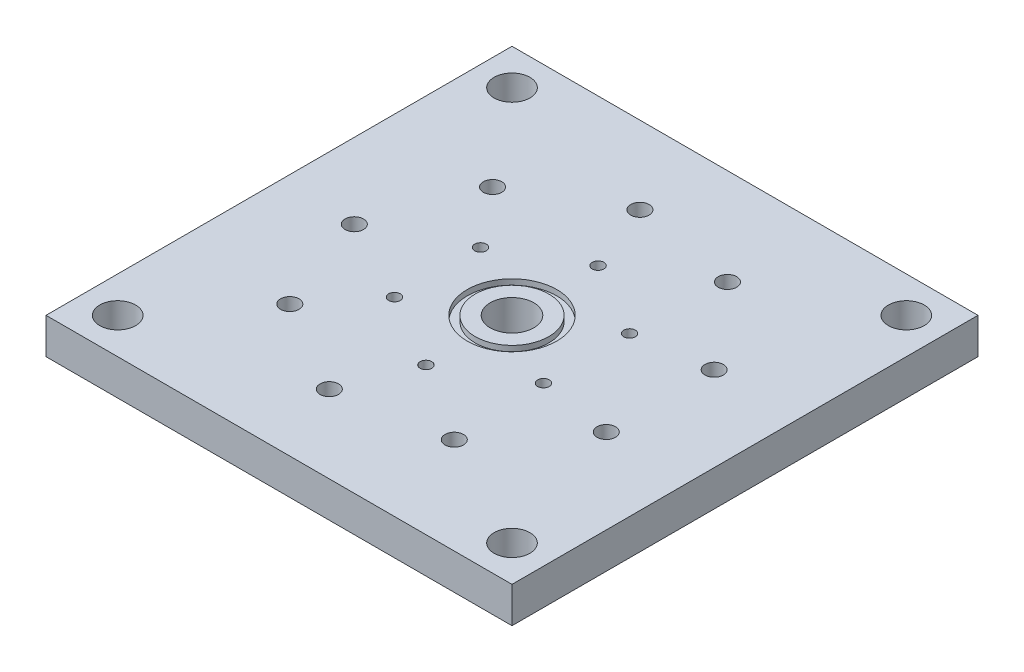
from build123d import *

# Parameters (mm, degrees)
SKETCH1_W           = 82.55
SKETCH1_H           = 82.55
BOSS_EXTRUDE1_DEPTH = 6.35
CUT_EXTRUDE1_REACH  = 60.716
SKETCH2_R           = 3.8608
SKETCH4_R           = 7.9248
SKETCH4_R_2         = 6.5278
CUT_EXTRUDE3_DEPTH  = 0.9779
SKETCH5_R           = 1.03251
CUT_EXTRUDE4_DEPTH  = 3.175
CIRPATTERN1_COUNT   = 6
CUT_EXTRUDE5_REACH  = 60.716
SKETCH6_R           = 1.63195
CIRPATTERN2_COUNT   = 9
CUT_EXTRUDE6_REACH  = 60.716
SKETCH7_R           = 3.175


with BuildPart() as part:
    # Sketch1 → Boss-Extrude1 (new body)
    with BuildSketch(Plane(origin=(0, 0, 0), x_dir=(1, 0, 0), z_dir=(0, 1, 0))):
        Rectangle(SKETCH1_W, SKETCH1_H)
    extrude(amount=BOSS_EXTRUDE1_DEPTH)

    # Sketch2 → Cut-Extrude1 (cut, up to next)
    with BuildSketch(Plane(origin=(0, 6.35, 0), x_dir=(1, 0, 0), z_dir=(0, 1, 0)), mode=Mode.PRIVATE) as cut_extrude1_sk1:
        with Locations(Location((0, 0, 0), (0, 0, 270))):
            Circle(SKETCH2_R)
    cut_extrude1_tool1 = extrude(cut_extrude1_sk1.sketch, amount=-CUT_EXTRUDE1_REACH, mode=Mode.PRIVATE) & part.part
    add(cut_extrude1_tool1.solids().sort_by_distance((0, 6.35, 0))[0], mode=Mode.SUBTRACT)

    # Sketch4 → Cut-Extrude3 (cut)
    with BuildSketch(Plane(origin=(0, 6.35, 0), x_dir=(1, 0, 0), z_dir=(0, 1, 0))):
        with Locations(Location((0, 0, 0), (0, 0, 270))):
            Circle(SKETCH4_R)
        with Locations(Location((0, 0, 0), (0, 0, 270))):
            Circle(SKETCH4_R_2, mode=Mode.SUBTRACT)
    extrude(amount=-CUT_EXTRUDE3_DEPTH, mode=Mode.SUBTRACT)

    # Sketch5 → Cut-Extrude4 (cut)
    with BuildSketch(Plane(origin=(0, 6.35, 0), x_dir=(1, 0, 0), z_dir=(0, 1, 0))):
        with Locations(Location((0, -15.24, 0), (0, 0, 270))):
            Circle(SKETCH5_R)
    cut_extrude4 = extrude(amount=-CUT_EXTRUDE4_DEPTH, mode=Mode.SUBTRACT)

    # CirPattern1: Cut-Extrude4 ×6 about axis
    cirpattern1_axis = Axis((0, 0, 0), (0, 1, 0))
    for i in range(1, CIRPATTERN1_COUNT):
        add(cut_extrude4.rotate(cirpattern1_axis, i * 360 / CIRPATTERN1_COUNT), mode=Mode.SUBTRACT)

    # Sketch6 → Cut-Extrude5 (cut, up to next)
    with BuildSketch(Plane(origin=(0, 6.35, 0), x_dir=(1, 0, 0), z_dir=(0, 1, 0)), mode=Mode.PRIVATE) as cut_extrude5_sk1:
        with Locations(Location((13.97, -24.196749782, 0), (0, 0, 270))):
            Circle(SKETCH6_R)
    cut_extrude5_tool1 = extrude(cut_extrude5_sk1.sketch, amount=-CUT_EXTRUDE5_REACH, mode=Mode.PRIVATE) & part.part
    cut_extrude5 = cut_extrude5_tool1.solids().sort_by_distance((13.97, 6.35, 24.19675))[0]
    add(cut_extrude5, mode=Mode.SUBTRACT)

    # CirPattern2: Cut-Extrude5 ×9 about axis
    cirpattern2_axis = Axis((0, 0, 0), (0, 1, 0))
    for i in range(1, CIRPATTERN2_COUNT):
        add(cut_extrude5.rotate(cirpattern2_axis, i * 360 / CIRPATTERN2_COUNT), mode=Mode.SUBTRACT)

    # Sketch7 → Cut-Extrude6 (cut, up to next)
    with BuildSketch(Plane(origin=(0, 6.35, 0), x_dir=(1, 0, 0), z_dir=(0, 1, 0)), mode=Mode.PRIVATE) as cut_extrude6_sk1:
        with Locations(Location((34.925, 34.925, 0), (0, 0, 270))):
            Circle(SKETCH7_R)
    cut_extrude6_tool1 = extrude(cut_extrude6_sk1.sketch, amount=-CUT_EXTRUDE6_REACH, mode=Mode.PRIVATE) & part.part
    # Sketch7 → Cut-Extrude6 (cut, up to next)
    with BuildSketch(Plane(origin=(0, 6.35, 0), x_dir=(1, 0, 0), z_dir=(0, 1, 0)), mode=Mode.PRIVATE) as cut_extrude6_sk2:
        with Locations(Location((34.925, -34.925, 0), (0, 0, 90))):
            Circle(SKETCH7_R)
    cut_extrude6_tool2 = extrude(cut_extrude6_sk2.sketch, amount=-CUT_EXTRUDE6_REACH, mode=Mode.PRIVATE) & part.part
    # Sketch7 → Cut-Extrude6 (cut, up to next)
    with BuildSketch(Plane(origin=(0, 6.35, 0), x_dir=(1, 0, 0), z_dir=(0, 1, 0)), mode=Mode.PRIVATE) as cut_extrude6_sk3:
        with Locations(Location((-34.925, -34.925, 0), (0, 0, 270))):
            Circle(SKETCH7_R)
    cut_extrude6_tool3 = extrude(cut_extrude6_sk3.sketch, amount=-CUT_EXTRUDE6_REACH, mode=Mode.PRIVATE) & part.part
    # Sketch7 → Cut-Extrude6 (cut, up to next)
    with BuildSketch(Plane(origin=(0, 6.35, 0), x_dir=(1, 0, 0), z_dir=(0, 1, 0)), mode=Mode.PRIVATE) as cut_extrude6_sk4:
        with Locations(Location((-34.925, 34.925, 0), (0, 0, 90))):
            Circle(SKETCH7_R)
    cut_extrude6_tool4 = extrude(cut_extrude6_sk4.sketch, amount=-CUT_EXTRUDE6_REACH, mode=Mode.PRIVATE) & part.part
    add(cut_extrude6_tool1.solids().sort_by_distance((34.925, 6.35, -34.925))[0], mode=Mode.SUBTRACT)
    add(cut_extrude6_tool2.solids().sort_by_distance((34.925, 6.35, 34.925))[0], mode=Mode.SUBTRACT)
    add(cut_extrude6_tool3.solids().sort_by_distance((-34.925, 6.35, 34.925))[0], mode=Mode.SUBTRACT)
    add(cut_extrude6_tool4.solids().sort_by_distance((-34.925, 6.35, -34.925))[0], mode=Mode.SUBTRACT)


solid = part.part
